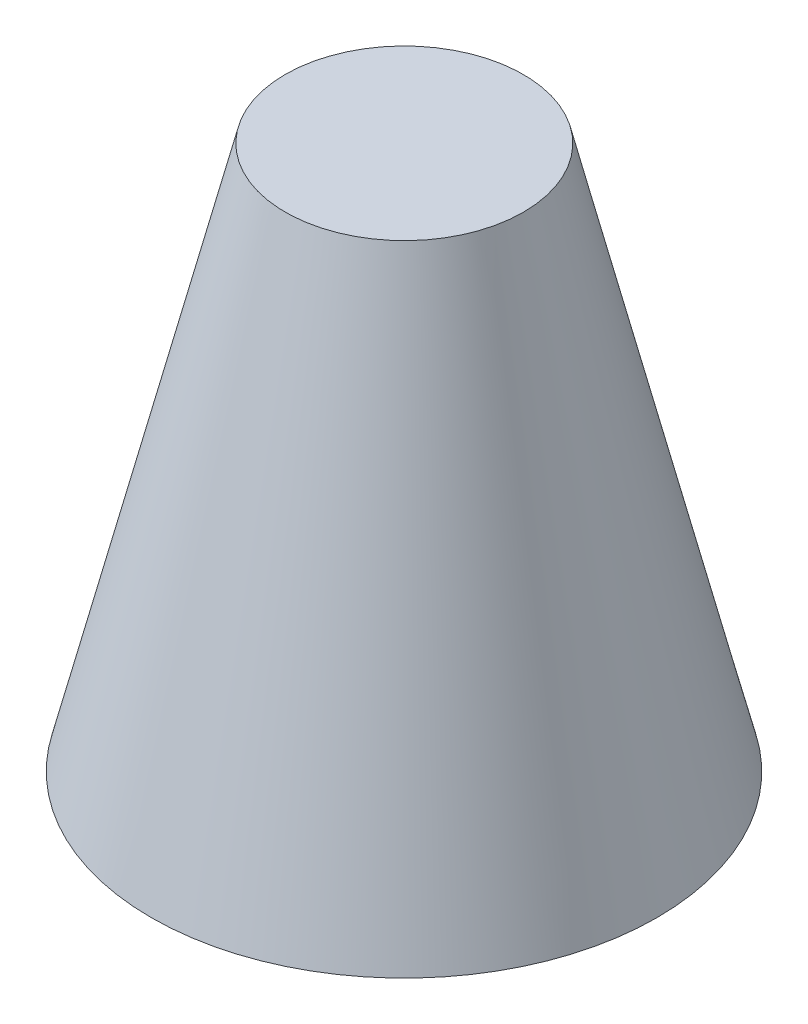
from build123d import *

# Parameters (mm, degrees)
CUT_EXTRUDE2_DEPTH      = 0.5
CUT_EXTRUDE2_DEPTH_BACK = 0.5
SKETCH2_R               = 7.638661607


with BuildPart() as part:
    # Sketch1 → Revolve1 (revolve)
    with BuildSketch(Plane.XY):
        Polygon((302.977541495, 5.050609022), (311.053956716, 37.810001098), (317.996043956, 37.810001098), (317.987740872, 23.109038281), (308.990985227, 23.109038281), (304.538907099, 5.050609022), align=None)
    revolve(axis=Axis((317.996043956, 37.810001098, 0), (-0.0005647985914274973, -0.9999998405012629, 0)))

    # Sketch2 → Cut-Extrude2 (cut, two sides: drawn at the far end of the back side and taken through both)
    with BuildSketch(Plane(origin=(0.021454257, 37.985671845, 0), x_dir=(0.9999998405012629, -0.0005647985914269507, 0), z_dir=(0.0005647985914269507, 0.9999998405012629, 0)).offset(-CUT_EXTRUDE2_DEPTH_BACK)):
        with Locations((317.974638201, 0)):
            Circle(SKETCH2_R)
    extrude(amount=CUT_EXTRUDE2_DEPTH + CUT_EXTRUDE2_DEPTH_BACK, mode=Mode.SUBTRACT)


solid = part.part
